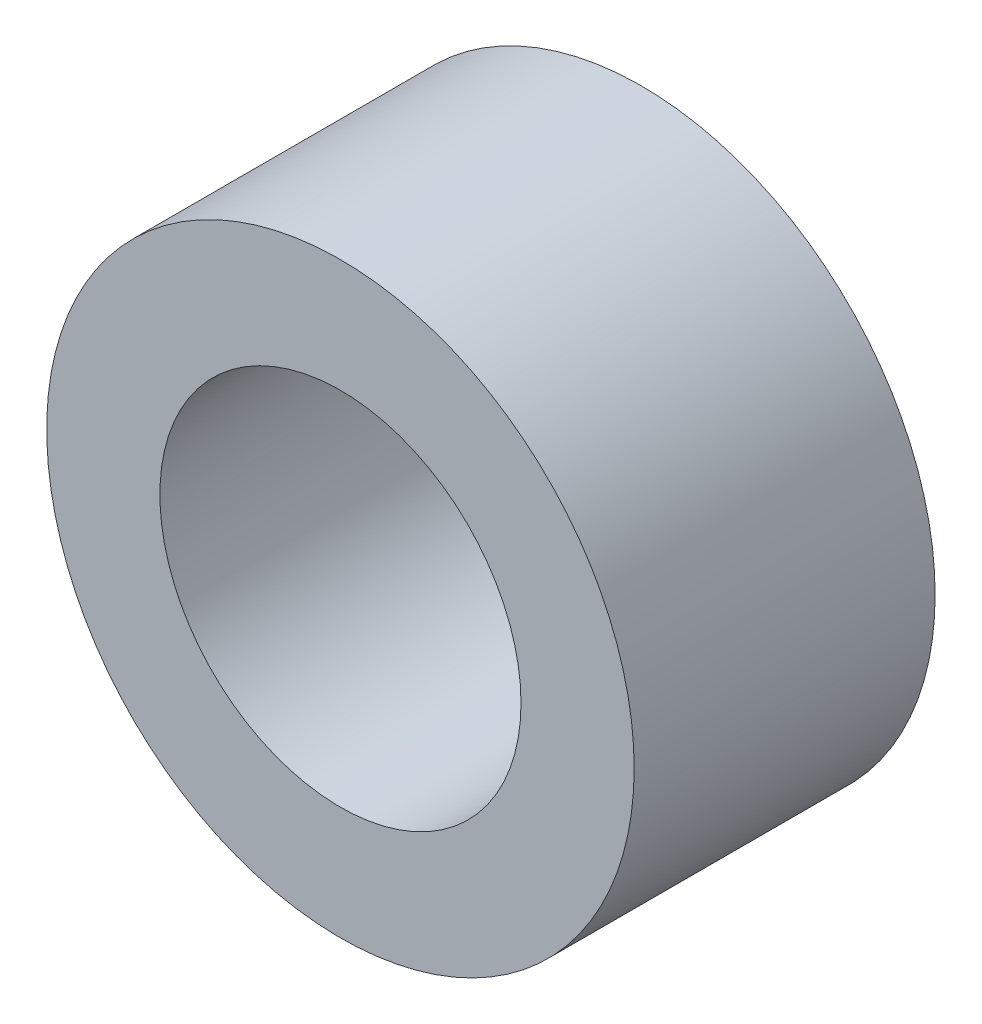
from build123d import *

# Parameters (mm, degrees)
SKETCH1_R           = 4.880474561
SKETCH1_R_2         = 3
BOSS_EXTRUDE1_DEPTH = 5


with BuildPart() as part:
    # Sketch1 → Boss-Extrude1 (new body)
    with BuildSketch(Plane.XY):
        Circle(SKETCH1_R)
        Circle(SKETCH1_R_2, mode=Mode.SUBTRACT)
    extrude(amount=BOSS_EXTRUDE1_DEPTH)


solid = part.part
